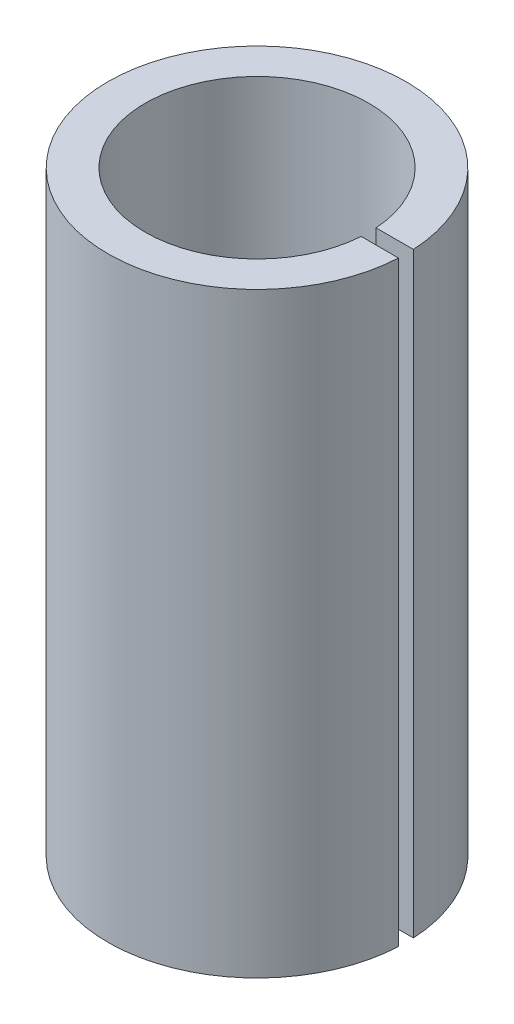
from build123d import *

# Parameters (mm, degrees)
SKETCH1_W          = 0.5
SKETCH1_H          = 8
SKETCH2_W          = 0.2
SKETCH2_H          = 8
CUT_EXTRUDE1_DEPTH = 4


with BuildPart() as part:
    # Sketch1 → Revolve1 (revolve)
    with BuildSketch(Plane.XY, mode=Mode.PRIVATE) as revolve1_sk:
        with Locations((1.75, 4)):
            Rectangle(SKETCH1_W, SKETCH1_H)
    revolve(revolve1_sk.sketch.rotate(Axis((0, 0, 0), (0, 1, 0)), 270), axis=Axis((0, 0, 0), (0, 1, 0)))

    # Sketch2 → Cut-Extrude1 (cut)
    with BuildSketch(Plane(origin=(0, 0, 0), x_dir=(0, 0, -1), z_dir=(1, 0, 0))):
        with Locations((0, 4)):
            Rectangle(SKETCH2_W, SKETCH2_H)
    extrude(amount=CUT_EXTRUDE1_DEPTH, mode=Mode.SUBTRACT)


solid = part.part
